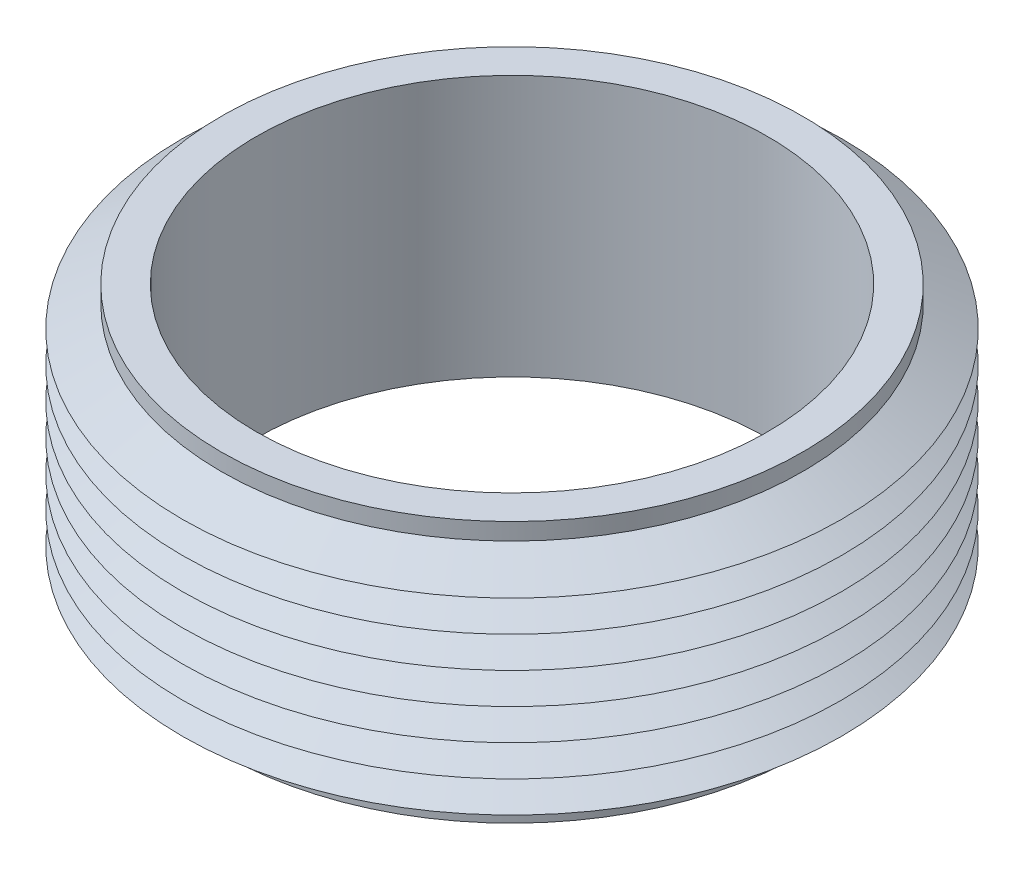
from build123d import *


with BuildPart() as part:
    # Sketch1 → Revolve-Thin1 (revolve)
    with BuildSketch(Plane.XY, mode=Mode.PRIVATE) as revolve_thin1_sk:
        Polygon((36.5, -1), (41.5, -1), (41.5, 1.36100674), (47.05164478, 3.931330757), (42.693587431, 6.382317526), (47.05164478, 8.400029378), (42.693587431, 10.851016147), (47.05164478, 12.868728), (42.693587431, 15.319714769), (47.05164478, 17.337426622), (42.693587431, 19.788413391), (47.05164478, 21.806125243), (42.693587431, 24.257112012), (47.05164478, 26.274823865), (42.693587431, 28.725810634), (47.05164478, 30.743522486), (41.5, 33.865787021), (41.5, 36.280890351), (36.5, 36.280890351), align=None)
        Polygon((37.5, 0), (40.5, 0), (40.5, 2), (44.858057349, 4.017711853), (40.5, 6.468698622), (44.858057349, 8.486410474), (40.5, 10.937397243), (44.858057349, 12.955109096), (40.5, 15.406095865), (44.858057349, 17.423807717), (40.5, 19.874794486), (44.858057349, 21.892506339), (40.5, 24.343493108), (44.858057349, 26.36120496), (40.5, 28.812191729), (44.858057349, 30.829903582), (40.5, 33.280890351), (40.5, 35.280890351), (37.5, 35.280890351), align=None, mode=Mode.SUBTRACT)
    revolve(revolve_thin1_sk.sketch.rotate(Axis((0, 76.319492769, 0), (0, -1, 0)), 90), axis=Axis((0, 76.319492769, 0), (0, -1, 0)))


solid = part.part
